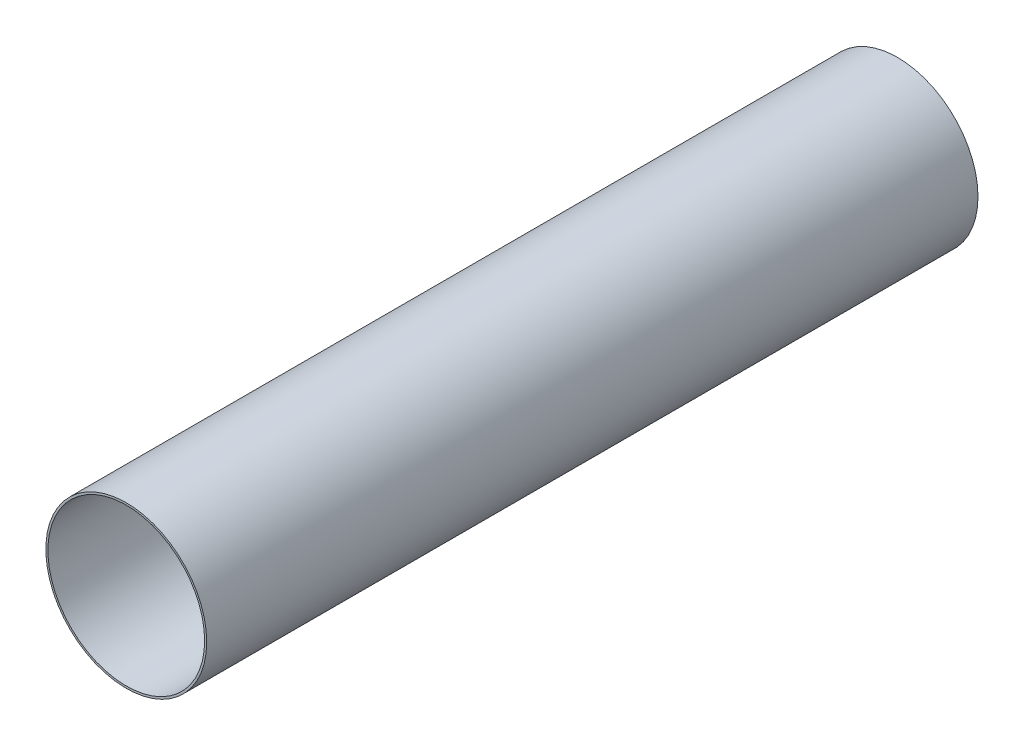
from build123d import *

# Parameters (mm, degrees)
SKETCH1_R           = 78.2
SKETCH1_R_2         = 76.2
BOSS_EXTRUDE1_DEPTH = 750


with BuildPart() as part:
    # Sketch1 → Boss-Extrude1 (new body)
    with BuildSketch(Plane.XY):
        Circle(SKETCH1_R)
        Circle(SKETCH1_R_2, mode=Mode.SUBTRACT)
    extrude(amount=BOSS_EXTRUDE1_DEPTH)


solid = part.part
